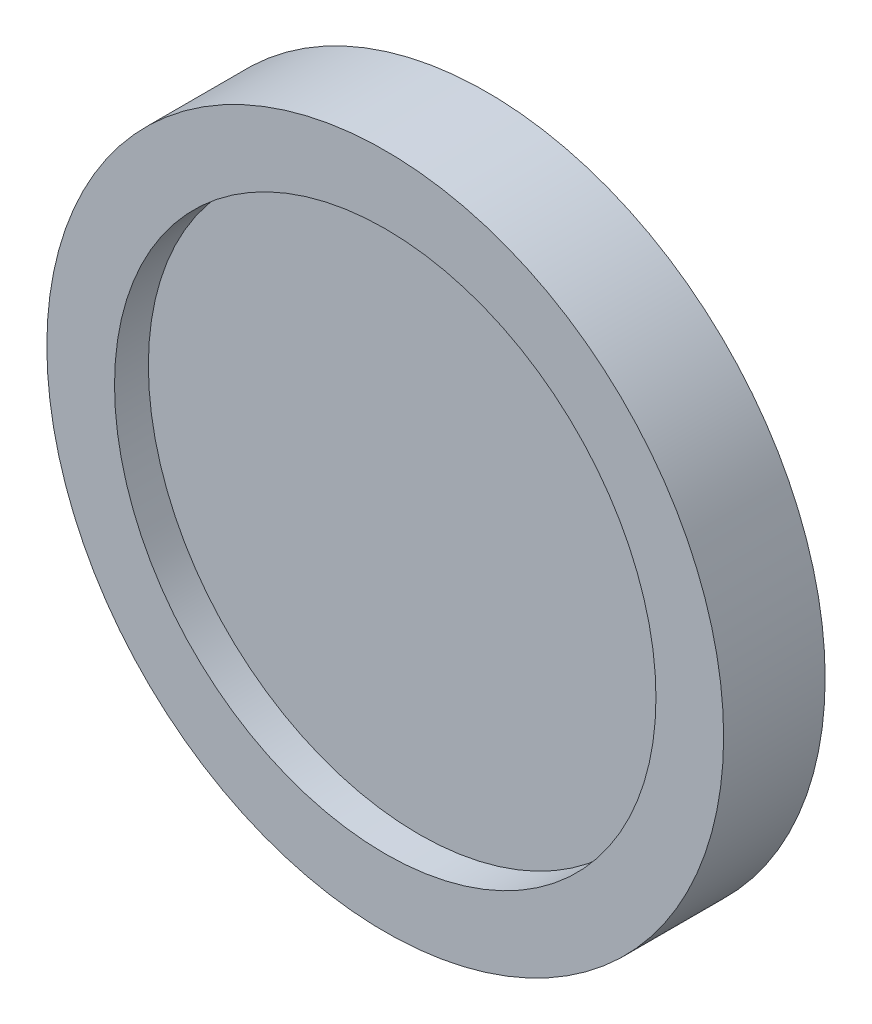
from build123d import *

# Parameters (mm, degrees)
SKETCH_1_R      = 50
EXTRUDE_1_DEPTH = 15
SHELL_1_T       = -10


with BuildPart() as part:
    # 草图1 → 凸台-拉伸1 (new body)
    with BuildSketch(Plane.XY):
        Circle(SKETCH_1_R)
    extrude(amount=EXTRUDE_1_DEPTH)

    # 抽壳1
    shell_1_openings = [part.faces().sort_by_distance(p)[0] for p in [
        (0, 0, 15),
    ]]
    offset(amount=SHELL_1_T, openings=shell_1_openings, kind=Kind.INTERSECTION)


solid = part.part
